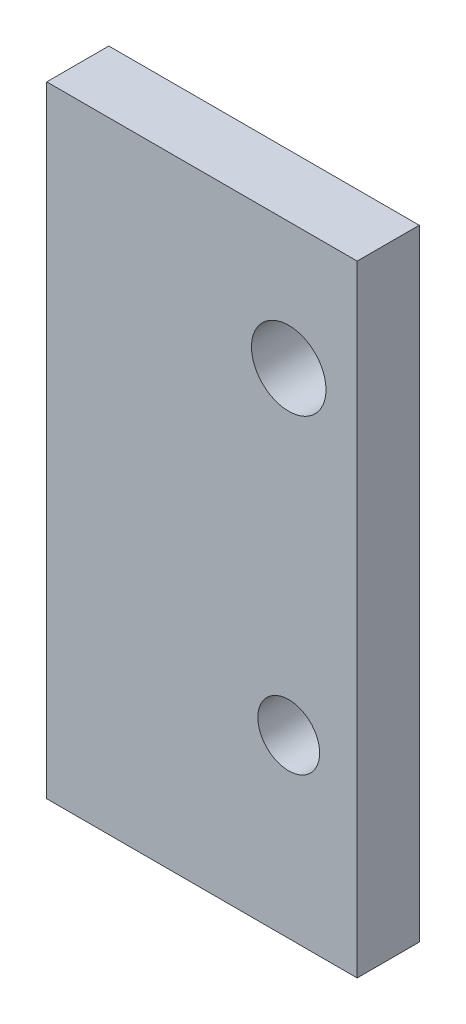
from build123d import *

# Parameters (mm, degrees)
SKETCH1_W           = 12.7
SKETCH1_H           = 25.4
BOSS_EXTRUDE1_DEPTH = 2.54
CUT_EXTRUDE1_REACH  = 16.424
SKETCH2_R           = 1.524
SKETCH2_R_2         = 1.26365


with BuildPart() as part:
    # Sketch1 → Boss-Extrude1 (new body)
    with BuildSketch(Plane.XY):
        Rectangle(SKETCH1_W, SKETCH1_H)
    extrude(amount=BOSS_EXTRUDE1_DEPTH)

    # Sketch2 → Cut-Extrude1 (cut, up to next)
    with BuildSketch(Plane.XY.offset(2.54), mode=Mode.PRIVATE) as cut_extrude1_sk1:
        with Locations((3.55, 7.501932673)):
            Circle(SKETCH2_R)
    cut_extrude1_tool1 = extrude(cut_extrude1_sk1.sketch, amount=-CUT_EXTRUDE1_REACH, mode=Mode.PRIVATE) & part.part
    # Sketch2 → Cut-Extrude1 (cut, up to next)
    with BuildSketch(Plane.XY.offset(2.54), mode=Mode.PRIVATE) as cut_extrude1_sk2:
        with Locations((3.55, -5.498067327)):
            Circle(SKETCH2_R_2)
    cut_extrude1_tool2 = extrude(cut_extrude1_sk2.sketch, amount=-CUT_EXTRUDE1_REACH, mode=Mode.PRIVATE) & part.part
    add(cut_extrude1_tool1.solids().sort_by_distance((3.55, 7.501933, 2.54))[0], mode=Mode.SUBTRACT)
    add(cut_extrude1_tool2.solids().sort_by_distance((3.55, -5.498067, 2.54))[0], mode=Mode.SUBTRACT)


solid = part.part
